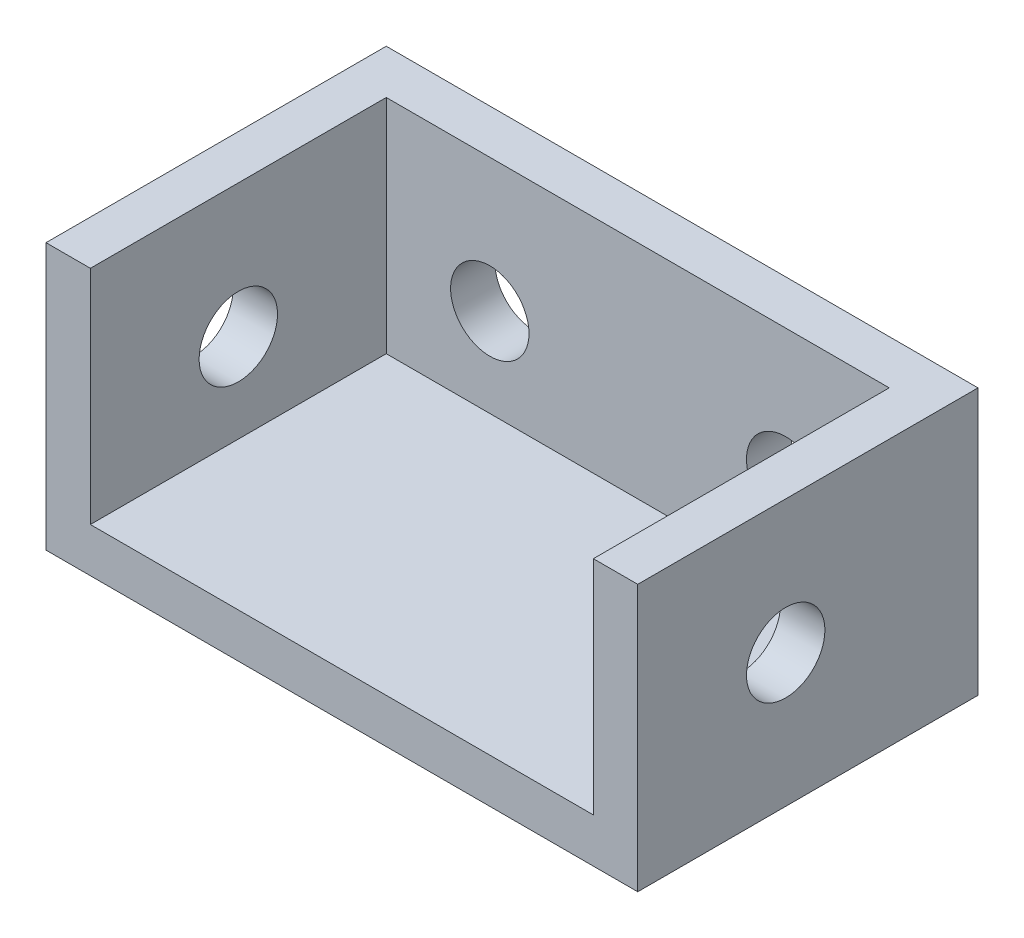
from build123d import *

# Parameters (mm, degrees)
SKETCH_1_W          = 40
SKETCH_1_H          = 18
SKETCH_1_R          = 2.65
EXTRUDE_1_DEPTH     = 3
SKETCH_3_W          = 20
SKETCH_3_H          = 18
SKETCH_3_R          = 2.65
EXTRUDE_2_DEPTH     = 40
SKETCH_5_W          = 34
SKETCH_5_H          = 20
CUT_EXTRUDE_2_DEPTH = 15


with BuildPart() as part:
    # 草图1 → 凸台-拉伸1 (new body)
    with BuildSketch(Plane.XY):
        Rectangle(SKETCH_1_W, SKETCH_1_H)
        with Locations((-10, 0)):
            Circle(SKETCH_1_R, mode=Mode.SUBTRACT)
        with Locations((10, 0)):
            Circle(SKETCH_1_R, mode=Mode.SUBTRACT)
    extrude(amount=EXTRUDE_1_DEPTH)

    # 草图3 → 凸台-拉伸2 (add)
    with BuildSketch(Plane.ZY.offset(20)):
        with Locations((13, 0)):
            Rectangle(SKETCH_3_W, SKETCH_3_H)
        with Locations(Location((13, 0, 0), (0, 0, 270))):
            Circle(SKETCH_3_R, mode=Mode.SUBTRACT)
    extrude(amount=-EXTRUDE_2_DEPTH)

    # 草图5 → 切除-拉伸2 (cut)
    with BuildSketch(Plane(origin=(0, 9, 0), x_dir=(1, 0, 0), z_dir=(0, 1, 0))):
        with Locations((0, -13)):
            Rectangle(SKETCH_5_W, SKETCH_5_H)
    extrude(amount=-CUT_EXTRUDE_2_DEPTH, mode=Mode.SUBTRACT)


solid = part.part
